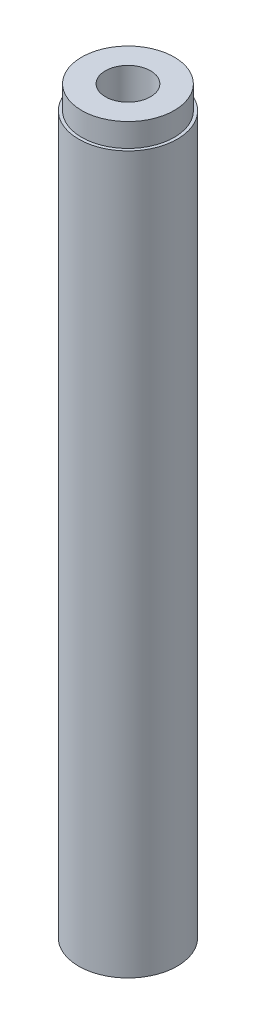
from build123d import *

# Parameters (mm, degrees)
SKETCH1_R           = 6.55
SKETCH1_R_2         = 3
BOSS_EXTRUDE1_DEPTH = 98.3
CUT_EXTRUDE1_START  = -3.1
SKETCH2_R           = 6.55
SKETCH2_R_2         = 6.15
CUT_EXTRUDE1_DEPTH  = 3.1


with BuildPart() as part:
    # Sketch1 → Boss-Extrude1 (new body)
    with BuildSketch(Plane(origin=(0, 0, 0), x_dir=(1, 0, 0), z_dir=(0, 1, 0))):
        with Locations(Location((0, 0, 0), (0, 0, 270))):
            Circle(SKETCH1_R)
        with Locations(Location((0, 0, 0), (0, 0, 270))):
            Circle(SKETCH1_R_2, mode=Mode.SUBTRACT)
    extrude(amount=BOSS_EXTRUDE1_DEPTH)

    # Sketch2 → Cut-Extrude1 (cut)
    with BuildSketch(Plane(origin=(0, 98.3, 0), x_dir=(1, 0, 0), z_dir=(0, 1, 0)).offset(CUT_EXTRUDE1_START)):
        with Locations(Location((0, 0, 0), (0, 0, 270))):
            Circle(SKETCH2_R)
        with Locations(Location((0, 0, 0), (0, 0, 270))):
            Circle(SKETCH2_R_2, mode=Mode.SUBTRACT)
    extrude(amount=CUT_EXTRUDE1_DEPTH, mode=Mode.SUBTRACT)


solid = part.part
